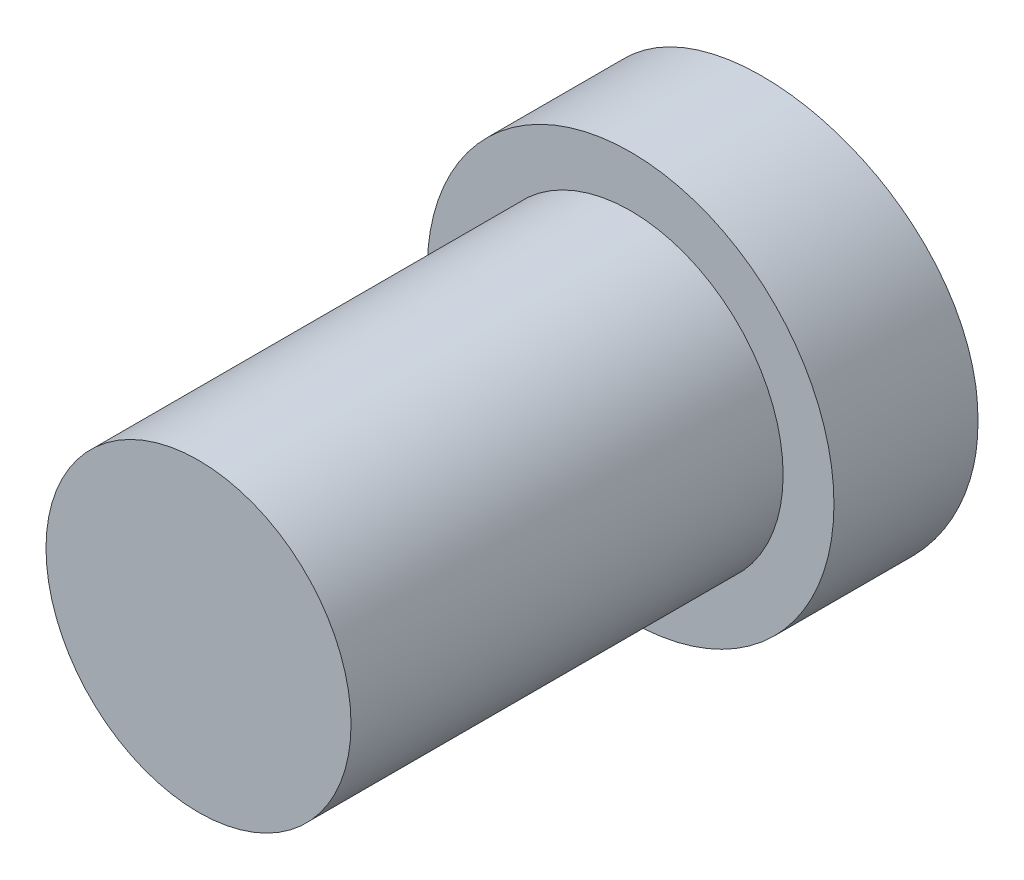
from build123d import *

# Parameters (mm, degrees)
SKETCH1_R               = 4.5
BOSS_EXTRUDE1_DEPTH     = 17
SKETCH1_3_R             = 6
SKETCH1_3_R_2           = 4.5
BOSS_EXTRUDE2_DEPTH     = 4.25
CUT_EXTRUDE1_DEPTH      = 20
CUT_EXTRUDE1_DEPTH_BACK = 20


with BuildPart() as part:
    # Sketch1 → Boss-Extrude1 (new body)
    with BuildSketch(Plane.XY):
        Circle(SKETCH1_R)
    extrude(amount=BOSS_EXTRUDE1_DEPTH)

    # Sketch1<3> → Boss-Extrude2 (add)
    with BuildSketch(Plane.XY):
        Circle(SKETCH1_3_R)
        Circle(SKETCH1_3_R_2, mode=Mode.SUBTRACT)
    extrude(amount=BOSS_EXTRUDE2_DEPTH)

    # Sketch2 → Cut-Extrude1 (cut, two sides: drawn at the far end of the back side and taken through both)
    with BuildSketch(Plane(origin=(0, 0, 0), x_dir=(0, 0, -1), z_dir=(1, 0, 0)).offset(-CUT_EXTRUDE1_DEPTH_BACK)):
        with BuildLine():
            Line((0, -6), (0, -0.843324554))
            ThreePointArc((0, -0.843324554), (-0.115349001, -3.426659852), (-0.37, -6))
            Line((-0.37, -6), (0, -6))
        make_face()
        with BuildLine():
            Line((0, 6), (-0.37, 6))
            ThreePointArc((-0.37, 6), (-0.115349001, 3.426659852), (0, 0.843324554))
            Line((0, 0.843324554), (0, 6))
        make_face()
    extrude(amount=CUT_EXTRUDE1_DEPTH + CUT_EXTRUDE1_DEPTH_BACK, mode=Mode.SUBTRACT)


solid = part.part
